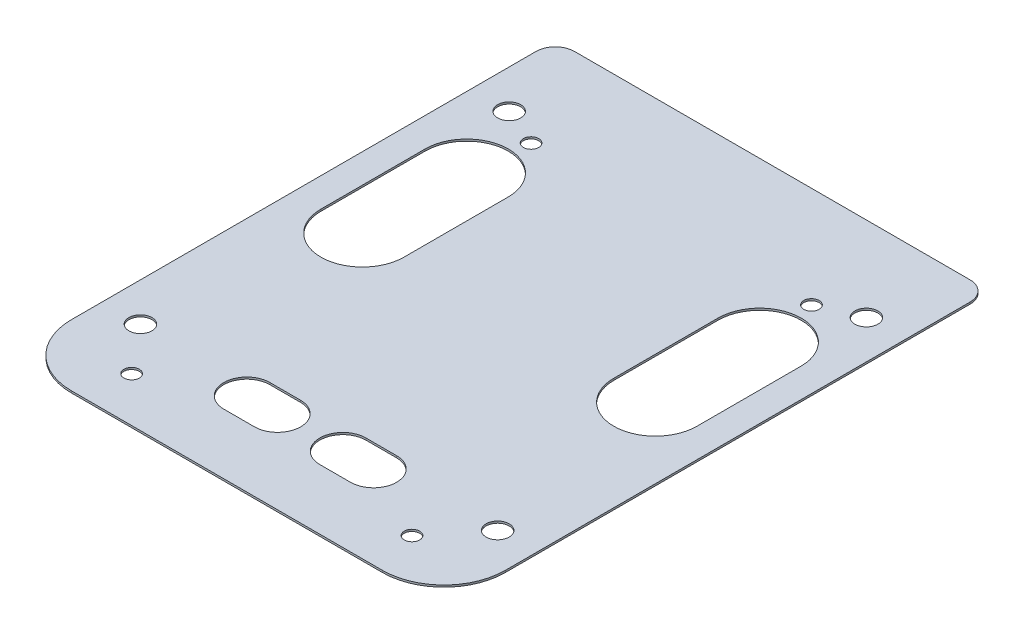
from build123d import *

# Parameters (mm, degrees)
SKETCH1_R           = 3.175
SKETCH1_R_2         = 4.7625
BOSS_EXTRUDE1_DEPTH = 0.79375


with BuildPart() as part:
    # Sketch1 → Boss-Extrude1 (new body)
    with BuildSketch(Plane(origin=(0, 0, 0), x_dir=(1, 0, 0), z_dir=(0, 1, 0))):
        with BuildLine():
            Line((-81.75625, 112.7125), (81.75625, 112.7125))
            ThreePointArc((81.75625, 112.7125), (87.368910076, 110.387660076), (89.69375, 104.775))
            Line((89.69375, 104.775), (89.69375, -87.3125))
            ThreePointArc((89.69375, -87.3125), (82.254262242, -105.273012242), (64.29375, -112.7125))
            Line((64.29375, -112.7125), (-64.29375, -112.7125))
            ThreePointArc((-64.29375, -112.7125), (-82.254262242, -105.273012242), (-89.69375, -87.3125))
            Line((-89.69375, -87.3125), (-89.69375, 104.775))
            ThreePointArc((-89.69375, 104.775), (-87.368910076, 110.387660076), (-81.75625, 112.7125))
        make_face()
        with Locations(Location((-57.94375, 70.96125, 0), (0, 0, 270))):
            Circle(SKETCH1_R, mode=Mode.SUBTRACT)
        with Locations(Location((57.94375, 70.96125, 0), (0, 0, 270))):
            Circle(SKETCH1_R, mode=Mode.SUBTRACT)
        with Locations(Location((57.94375, -94.13875, 0), (0, 0, 270))):
            Circle(SKETCH1_R, mode=Mode.SUBTRACT)
        with Locations(Location((-57.94375, -94.13875, 0), (0, 0, 270))):
            Circle(SKETCH1_R, mode=Mode.SUBTRACT)
        with Locations(Location((-73.81875, -74.6125, 0), (0, 0, 270))):
            Circle(SKETCH1_R_2, mode=Mode.SUBTRACT)
        with Locations(Location((-73.81875, 77.7875, 0), (0, 0, 270))):
            Circle(SKETCH1_R_2, mode=Mode.SUBTRACT)
        with Locations(Location((73.81875, 77.7875, 0), (0, 0, 270))):
            Circle(SKETCH1_R_2, mode=Mode.SUBTRACT)
        with Locations(Location((73.81875, -74.6125, 0), (0, 0, 270))):
            Circle(SKETCH1_R_2, mode=Mode.SUBTRACT)
        with BuildLine():
            Line((-26.19375, -68.73748), (-13.49375, -68.73748))
            ThreePointArc((-13.49375, -68.73748), (-3.96875, -78.26248), (-13.49375, -87.78748))
            Line((-13.49375, -87.78748), (-26.19375, -87.78748))
            ThreePointArc((-26.19375, -87.78748), (-35.71875, -78.26248), (-26.19375, -68.73748))
        make_face(mode=Mode.SUBTRACT)
        with BuildLine():
            Line((26.19375, -68.73748), (13.49375, -68.73748))
            ThreePointArc((13.49375, -68.73748), (3.96875, -78.26248), (13.49375, -87.78748))
            Line((13.49375, -87.78748), (26.19375, -87.78748))
            ThreePointArc((26.19375, -87.78748), (35.71875, -78.26248), (26.19375, -68.73748))
        make_face(mode=Mode.SUBTRACT)
        with BuildLine():
            Line((-43.34637, 46.94682), (-43.34637, 3.85572))
            ThreePointArc((-43.34637, 3.85572), (-60.52947, -13.32738), (-77.71257, 3.85572))
            Line((-77.71257, 3.85572), (-77.71257, 46.94682))
            ThreePointArc((-77.71257, 46.94682), (-60.52947, 64.12992), (-43.34637, 46.94682))
        make_face(mode=Mode.SUBTRACT)
        with BuildLine():
            Line((43.34637, 46.94682), (43.34637, 3.85572))
            ThreePointArc((43.34637, 3.85572), (60.52947, -13.32738), (77.71257, 3.85572))
            Line((77.71257, 3.85572), (77.71257, 46.94682))
            ThreePointArc((77.71257, 46.94682), (60.52947, 64.12992), (43.34637, 46.94682))
        make_face(mode=Mode.SUBTRACT)
    extrude(amount=BOSS_EXTRUDE1_DEPTH)


solid = part.part
